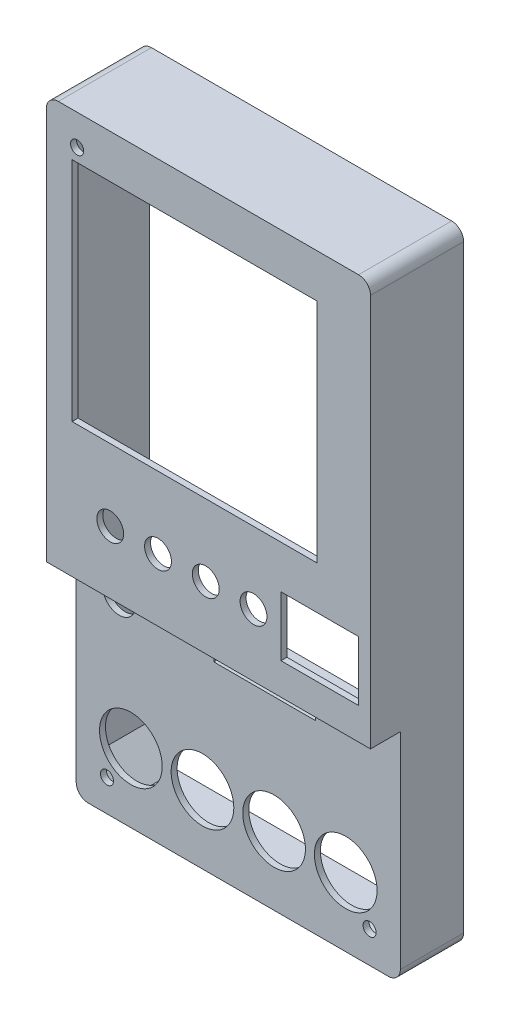
from build123d import *

# Parameters (mm, degrees)
SKICA1_W                 = 54.3
SKICA1_H                 = 36.5
P_IDAT_VYSUNUT_M1_DEPTH  = 1
SKICA4_W                 = 54.3
SKICA4_H                 = 67.8
SKICA4_W_2               = 51
SKICA4_H_2               = 64.5
P_IDAT_VYSUNUT_M2_DEPTH  = 6
SKICA5_W                 = 51
SKICA5_H                 = 64.5
P_IDAT_VYSUNUT_M3_DEPTH  = 1
SKICA2_R                 = 1.1
ODEBRAT_VYSUNUT_M1_DEPTH = 1
SKICA3_R                 = 5.25
SKICA3_R_2               = 2.75
SKICA3_W                 = 17
SKICA3_H                 = 3.5
ODEBRAT_VYSUNUT_M2_DEPTH = 1
SKICA6_W                 = 41
SKICA6_H                 = 38
SKICA6_R                 = 2.25
SKICA6_R_2               = 1.1
SKICA6_W_2               = 13
SKICA6_H_2               = 10
ODEBRAT_VYSUNUT_M3_DEPTH = 118.74115678
SKICA8_W                 = 54.3
SKICA8_H                 = 104.3
SKICA8_W_2               = 51
SKICA8_H_2               = 101
P_IDAT_VYSUNUT_M4_DEPTH  = 9.6
ZAOBLIT1_R               = 2
SKICA9_W                 = 5
SKICA9_H                 = 5
P_IDAT_VYSUNUT_M5_DEPTH  = 9.6


with BuildPart() as part:
    # Skica1 → Přidat vysunutím1 (new body)
    with BuildSketch(Plane.XY):
        with Locations((27.15, 18.25)):
            Rectangle(SKICA1_W, SKICA1_H)
    extrude(amount=P_IDAT_VYSUNUT_M1_DEPTH)

    # Skica4 → Přidat vysunutím2 (add)
    with BuildSketch(Plane.XY):
        with Locations((27.15, 70.4)):
            Rectangle(SKICA4_W, SKICA4_H)
        with Locations((27.15, 70.4)):
            Rectangle(SKICA4_W_2, SKICA4_H_2, mode=Mode.SUBTRACT)
    extrude(amount=P_IDAT_VYSUNUT_M2_DEPTH)

    # Skica5 → Přidat vysunutím3 (add)
    with BuildSketch(Plane.XY.offset(6)):
        with Locations((27.15, 70.4)):
            Rectangle(SKICA5_W, SKICA5_H)
    extrude(amount=-P_IDAT_VYSUNUT_M3_DEPTH)

    # Skica2 → Odebrat vysunutím1 (cut)
    with BuildSketch(Plane.XY.offset(1)):
        with Locations((49.15, 5.3)):
            Circle(SKICA2_R)
        with Locations((5.15, 5.3)):
            Circle(SKICA2_R)
    extrude(amount=-ODEBRAT_VYSUNUT_M1_DEPTH, mode=Mode.SUBTRACT)

    # Skica3 → Odebrat vysunutím2 (cut)
    with BuildSketch(Plane.XY.offset(1)):
        with Locations((9.15, 11.5)):
            Circle(SKICA3_R)
        with Locations((21.15, 11.5)):
            Circle(SKICA3_R)
        with Locations((33.15, 11.5)):
            Circle(SKICA3_R)
        with Locations((45.15, 11.5)):
            Circle(SKICA3_R)
        with Locations((7.2, 32.6)):
            Circle(SKICA3_R_2)
        with Locations((31.55, 32.75)):
            Rectangle(SKICA3_W, SKICA3_H)
    extrude(amount=-ODEBRAT_VYSUNUT_M2_DEPTH, mode=Mode.SUBTRACT)

    # Skica6 → Odebrat vysunutím3 (cut, through all)
    with BuildSketch(Plane.XY.offset(6)):
        with Locations((24.8, 78)):
            Rectangle(SKICA6_W, SKICA6_H)
        with Locations((34.7, 47)):
            Circle(SKICA6_R)
        with Locations((26.7, 47)):
            Circle(SKICA6_R)
        with Locations((18.7, 47)):
            Circle(SKICA6_R)
        with Locations((10.7, 47)):
            Circle(SKICA6_R)
        with Locations((5.15, 99.2)):
            Circle(SKICA6_R_2)
        with Locations((45.8, 46.8)):
            Rectangle(SKICA6_W_2, SKICA6_H_2)
    extrude(amount=-ODEBRAT_VYSUNUT_M3_DEPTH, mode=Mode.SUBTRACT)

    # Skica8 → Přidat vysunutím4 (add)
    with BuildSketch(Plane(origin=(0, 0, 0), x_dir=(-1, 0, 0), z_dir=(0, 0, -1))):
        with Locations((-27.15, 52.15)):
            Rectangle(SKICA8_W, SKICA8_H)
        with Locations((-27.15, 52.15)):
            Rectangle(SKICA8_W_2, SKICA8_H_2, mode=Mode.SUBTRACT)
    extrude(amount=P_IDAT_VYSUNUT_M4_DEPTH)

    # Zaoblit1
    zaoblit1_edges = [part.edges().sort_by_distance(p)[0] for p in [
        (0, 104.3, -1.8),
        (54.3, 104.3, -1.8),
        (54.3, 0, -4.3),
        (0, 0, -4.3),
    ]]
    fillet(zaoblit1_edges, radius=ZAOBLIT1_R)

    # Skica9 → Přidat vysunutím5 (add)
    with BuildSketch(Plane(origin=(0, 0, 0), x_dir=(-1, 0, 0), z_dir=(0, 0, -1))):
        Polygon((-1.65, 1.65), (-1.65, 6.35), (-6.35, 1.65), align=None)
        Polygon((-52.65, 1.65), (-52.65, 6.35), (-47.95, 1.65), align=None)
        with Locations((-18.4, 21.25)):
            Rectangle(SKICA9_W, SKICA9_H)
    extrude(amount=P_IDAT_VYSUNUT_M5_DEPTH)


solid = part.part
